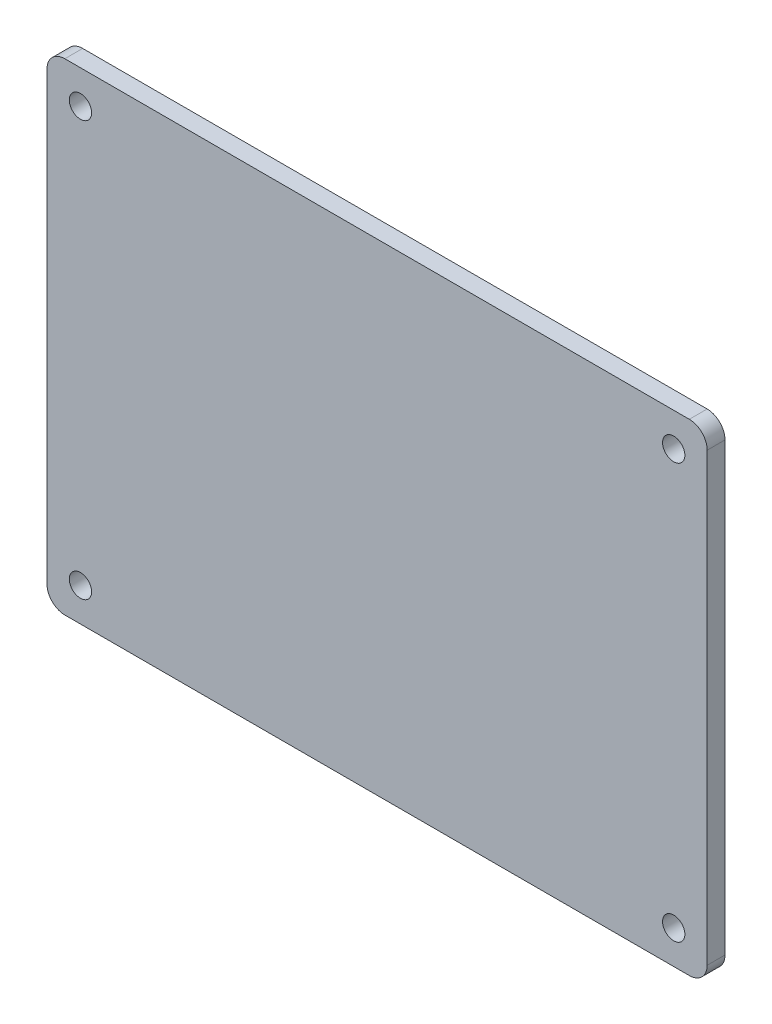
from build123d import *

# Parameters (mm, degrees)
SKETCH3_W           = 74
SKETCH3_H           = 54
BOSS_EXTRUDE1_DEPTH = 2
CUT_EXTRUDE2_REACH  = 47.848
SKETCH4_R           = 1.25
FILLET1_R           = 2


with BuildPart() as part:
    # Sketch3 → Boss-Extrude1 (new body)
    with BuildSketch(Plane.XY):
        Rectangle(SKETCH3_W, SKETCH3_H)
    extrude(amount=BOSS_EXTRUDE1_DEPTH)

    # Sketch4 → Cut-Extrude2 (cut, up to next)
    with BuildSketch(Plane(origin=(0, 0, 0), x_dir=(-1, 0, 0), z_dir=(0, 0, -1)), mode=Mode.PRIVATE) as cut_extrude2_sk1:
        with Locations((-33.25, 23.25)):
            Circle(SKETCH4_R)
    cut_extrude2_tool1 = extrude(cut_extrude2_sk1.sketch, amount=-CUT_EXTRUDE2_REACH, mode=Mode.PRIVATE) & part.part
    # Sketch4 → Cut-Extrude2 (cut, up to next)
    with BuildSketch(Plane(origin=(0, 0, 0), x_dir=(-1, 0, 0), z_dir=(0, 0, -1)), mode=Mode.PRIVATE) as cut_extrude2_sk2:
        with Locations((33.25, 23.25)):
            Circle(SKETCH4_R)
    cut_extrude2_tool2 = extrude(cut_extrude2_sk2.sketch, amount=-CUT_EXTRUDE2_REACH, mode=Mode.PRIVATE) & part.part
    # Sketch4 → Cut-Extrude2 (cut, up to next)
    with BuildSketch(Plane(origin=(0, 0, 0), x_dir=(-1, 0, 0), z_dir=(0, 0, -1)), mode=Mode.PRIVATE) as cut_extrude2_sk3:
        with Locations((33.25, -23.25)):
            Circle(SKETCH4_R)
    cut_extrude2_tool3 = extrude(cut_extrude2_sk3.sketch, amount=-CUT_EXTRUDE2_REACH, mode=Mode.PRIVATE) & part.part
    # Sketch4 → Cut-Extrude2 (cut, up to next)
    with BuildSketch(Plane(origin=(0, 0, 0), x_dir=(-1, 0, 0), z_dir=(0, 0, -1)), mode=Mode.PRIVATE) as cut_extrude2_sk4:
        with Locations((-33.25, -23.25)):
            Circle(SKETCH4_R)
    cut_extrude2_tool4 = extrude(cut_extrude2_sk4.sketch, amount=-CUT_EXTRUDE2_REACH, mode=Mode.PRIVATE) & part.part
    add(cut_extrude2_tool1.solids().sort_by_distance((33.25, 23.25, 0))[0], mode=Mode.SUBTRACT)
    add(cut_extrude2_tool2.solids().sort_by_distance((-33.25, 23.25, 0))[0], mode=Mode.SUBTRACT)
    add(cut_extrude2_tool3.solids().sort_by_distance((-33.25, -23.25, 0))[0], mode=Mode.SUBTRACT)
    add(cut_extrude2_tool4.solids().sort_by_distance((33.25, -23.25, 0))[0], mode=Mode.SUBTRACT)

    # Fillet1
    fillet1_edges = [part.edges().sort_by_distance(p)[0] for p in [
        (-37, 27, 1),
        (37, 27, 1),
        (37, -27, 1),
        (-37, -27, 1),
    ]]
    fillet(fillet1_edges, radius=FILLET1_R)


solid = part.part
